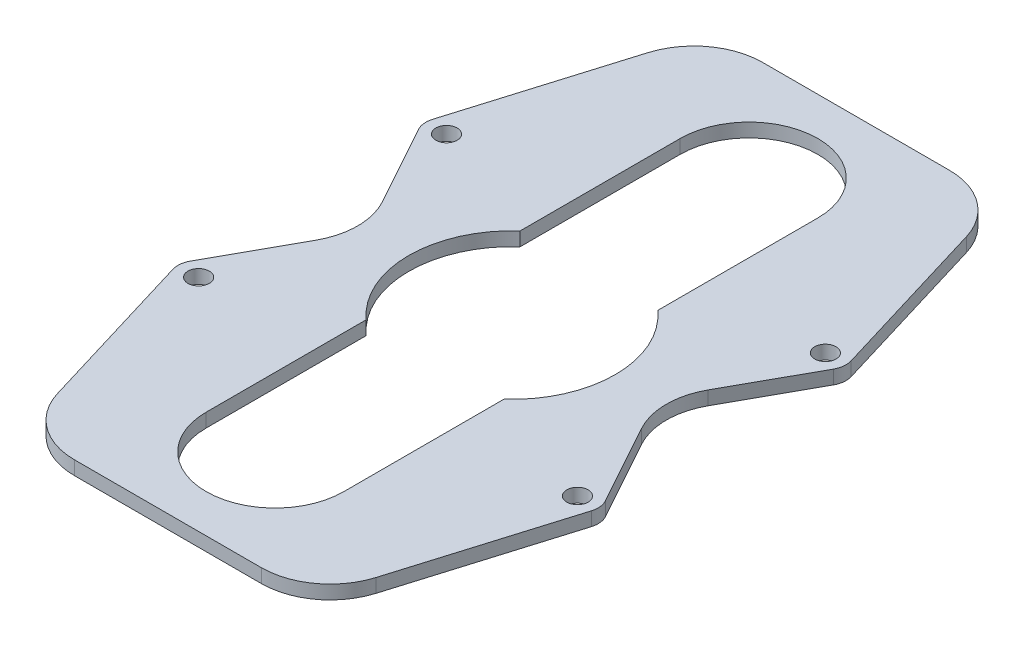
from build123d import *

# Parameters (mm, degrees)
SKETCH1_R           = 1.55
BOSS_EXTRUDE1_DEPTH = 2


with BuildPart() as part:
    # Sketch1 → Boss-Extrude1 (new body)
    with BuildSketch(Plane(origin=(0, 0, 0), x_dir=(1, 0, 0), z_dir=(0, 1, 0))):
        with BuildLine():
            ThreePointArc((-23.146596832, -42.890430613), (-19.535637384, -48.028209829), (-13.573435866, -50))
            Line((-13.573435866, -50), (13.573435866, -50))
            ThreePointArc((13.573435866, -50), (19.535637384, -48.028209829), (23.146596832, -42.890430613))
            Line((23.146596832, -42.890430613), (30.39694829, -18.877129184))
            ThreePointArc((30.39694829, -18.877129184), (30.508221739, -17.693159259), (30.150742695, -16.558974398))
            Line((30.150742695, -16.558974398), (23.672863187, -4.836752006))
            ThreePointArc((23.672863187, -4.836752006), (22.425338839, 0), (23.672863187, 4.836752006))
            Line((23.672863187, 4.836752006), (30.150742695, 16.558974398))
            ThreePointArc((30.150742695, 16.558974398), (30.508221739, 17.693159259), (30.39694829, 18.877129184))
            Line((30.39694829, 18.877129184), (23.146596832, 42.890430613))
            ThreePointArc((23.146596832, 42.890430613), (19.535637384, 48.028209829), (13.573435866, 50))
            Line((13.573435866, 50), (-13.573435866, 50))
            ThreePointArc((-13.573435866, 50), (-19.535637384, 48.028209829), (-23.146596832, 42.890430613))
            Line((-23.146596832, 42.890430613), (-30.39694829, 18.877129184))
            ThreePointArc((-30.39694829, 18.877129184), (-30.508221739, 17.693159259), (-30.150742695, 16.558974398))
            Line((-30.150742695, 16.558974398), (-23.672863187, 4.836752006))
            ThreePointArc((-23.672863187, 4.836752006), (-22.425338839, 0), (-23.672863187, -4.836752006))
            Line((-23.672863187, -4.836752006), (-30.150742695, -16.558974398))
            ThreePointArc((-30.150742695, -16.558974398), (-30.508221739, -17.693159259), (-30.39694829, -18.877129184))
            Line((-30.39694829, -18.877129184), (-23.146596832, -42.890430613))
        make_face()
        with BuildLine():
            ThreePointArc((10, -34.438564592), (0, -44.438564592), (-10, -34.438564592))
            Line((-10, -34.438564592), (-10, -11.180339887))
            ThreePointArc((-10, -11.180339887), (-15, 0), (-10, 11.180339887))
            Line((-10, 11.180339887), (-10, 34.438564592))
            ThreePointArc((-10, 34.438564592), (0, 44.438564592), (10, 34.438564592))
            Line((10, 34.438564592), (10, 11.180339887))
            ThreePointArc((10, 11.180339887), (15, 0), (10, -11.180339887))
            Line((10, -11.180339887), (10, -34.438564592))
        make_face(mode=Mode.SUBTRACT)
        with Locations((-27.525, -18.01)):
            Circle(SKETCH1_R, mode=Mode.SUBTRACT)
        with Locations((-27.525, 18.01)):
            Circle(SKETCH1_R, mode=Mode.SUBTRACT)
        with Locations((27.525, 18.01)):
            Circle(SKETCH1_R, mode=Mode.SUBTRACT)
        with Locations((27.525, -18.01)):
            Circle(SKETCH1_R, mode=Mode.SUBTRACT)
    extrude(amount=BOSS_EXTRUDE1_DEPTH)


solid = part.part
